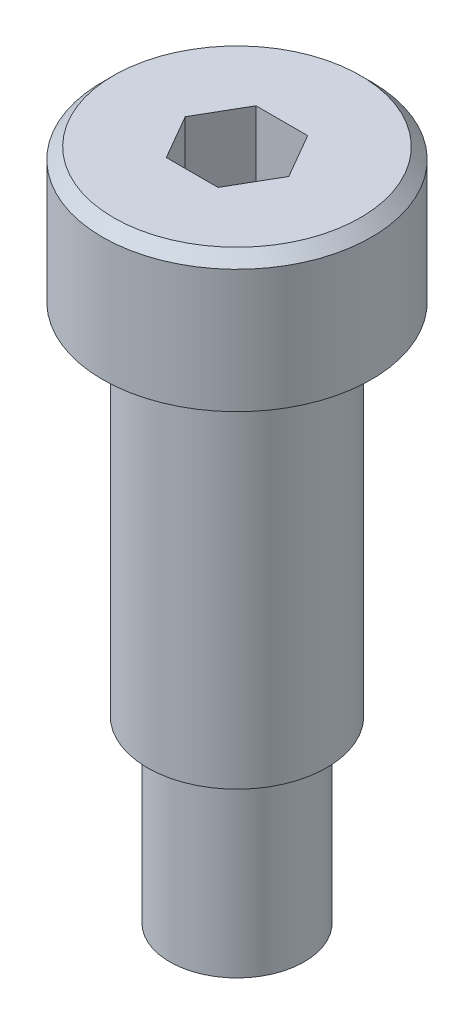
from build123d import *

# Parameters (mm, degrees)
SKETCH1_R           = 3
BOSS_EXTRUDE1_DEPTH = 3
SKETCH2_R           = 2
BOSS_EXTRUDE2_DEPTH = 8
SKETCH3_R           = 1.5
BOSS_EXTRUDE3_DEPTH = 4
CUT_EXTRUDE1_DEPTH  = 2
CHAMFER1_SIZE       = 0.25


with BuildPart() as part:
    # Sketch1 → Boss-Extrude1 (new body)
    with BuildSketch(Plane(origin=(0, 0, 0), x_dir=(1, 0, 0), z_dir=(0, 1, 0))):
        with Locations(Location((0, 0, 0), (0, 0, 270))):
            Circle(SKETCH1_R)
    extrude(amount=BOSS_EXTRUDE1_DEPTH)

    # Sketch2 → Boss-Extrude2 (add)
    with BuildSketch(Plane.XZ):
        with Locations(Location((0, 0, 0), (0, 0, 90))):
            Circle(SKETCH2_R)
    extrude(amount=BOSS_EXTRUDE2_DEPTH)

    # Sketch3 → Boss-Extrude3 (add)
    with BuildSketch(Plane.XZ.offset(8)):
        with Locations(Location((0, 0, 0), (0, 0, 270))):
            Circle(SKETCH3_R)
    extrude(amount=BOSS_EXTRUDE3_DEPTH)

    # Sketch4 → Cut-Extrude1 (cut)
    with BuildSketch(Plane(origin=(0, 3, 0), x_dir=(1, 0, 0), z_dir=(0, 1, 0))):
        Polygon((0.577350269, 1), (-0.577350269, 1), (-1.154700538, 0), (-0.577350269, -1), (0.577350269, -1), (1.154700538, 0), align=None)
    extrude(amount=-CUT_EXTRUDE1_DEPTH, mode=Mode.SUBTRACT)

    # Chamfer1
    chamfer1_edges = [part.edges().sort_by_distance(p)[0] for p in [
        (0, 3, -3),
    ]]
    chamfer(chamfer1_edges, length=CHAMFER1_SIZE)


solid = part.part
